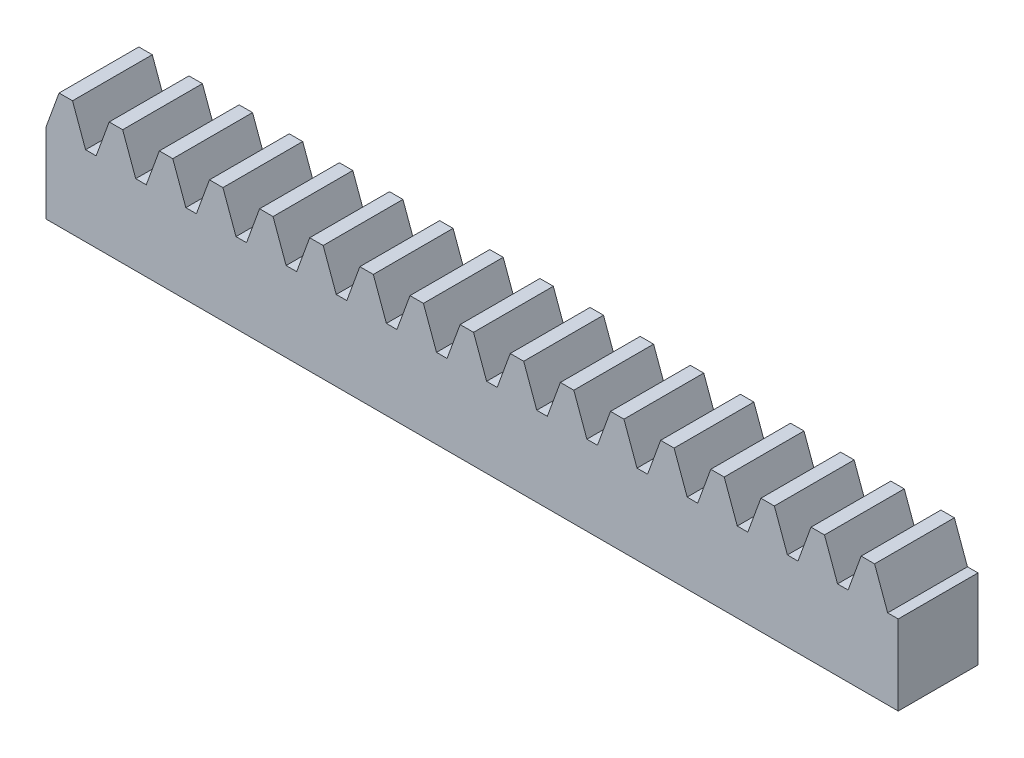
from build123d import *

# Parameters (mm, degrees)
SKETCH_1_W             = 106.814150222
SKETCH_1_H             = 10
EXTRUDE_1_DEPTH        = 10
EXTRUDE_2_DEPTH        = 10
PATTERN_LINEAR_1_COUNT = 17
PATTERN_LINEAR_1_PITCH = 6.283185307


with BuildPart() as part:
    # 草图1 → 拉伸1 (new body)
    with BuildSketch(Plane.XY):
        with Locations((53.407075111, -5)):
            Rectangle(SKETCH_1_W, SKETCH_1_H)
    extrude(amount=EXTRUDE_1_DEPTH)

    # 草图2 → 拉伸2 (add)
    with BuildSketch(Plane.XY.offset(10)):
        Polygon((0, 0), (1.637866054, 4.5), (3.323577771, 4.5), (4.961443825, 0), align=None)
    extrude_2 = extrude(amount=-EXTRUDE_2_DEPTH)

    # 阵列(线性)1: 拉伸2 ×17
    with Locations(*[(i * PATTERN_LINEAR_1_PITCH, 0, 0) for i in range(1, PATTERN_LINEAR_1_COUNT)]):
        add(extrude_2)


solid = part.part
